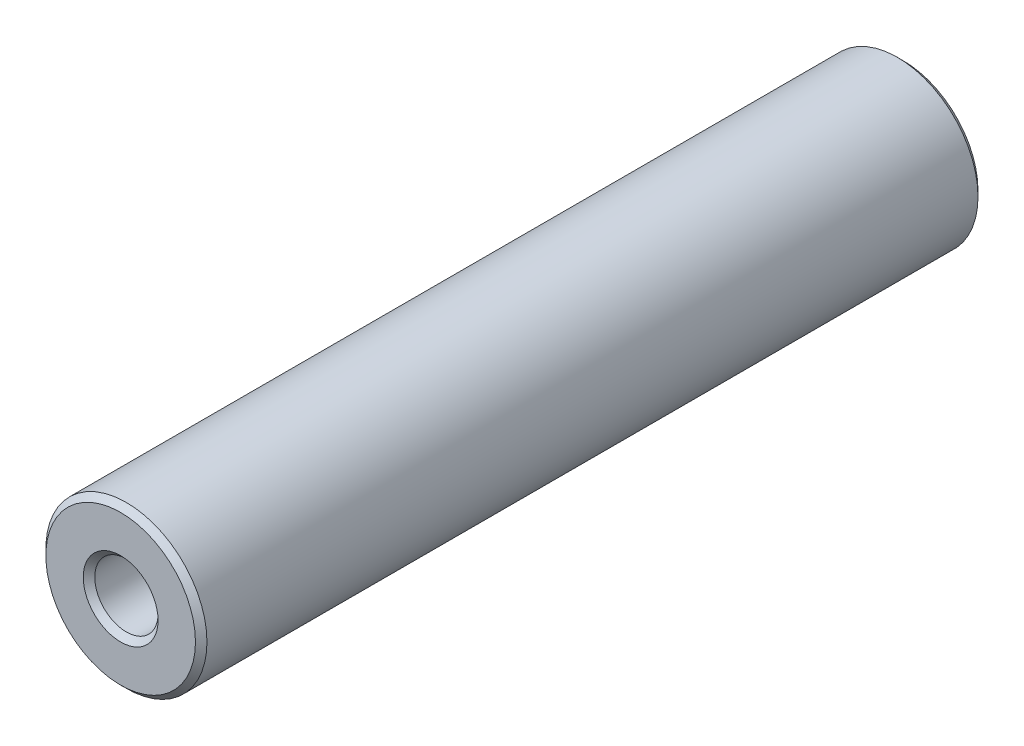
from build123d import *

# Parameters (mm, degrees)
SKETCH1_R           = 7
SKETCH1_R_2         = 2.75
BOSS_EXTRUDE1_DEPTH = 34
CHAMFER1_SIZE       = 0.5
CHAMFER2_SIZE       = 0.5


with BuildPart() as part:
    # Sketch1 → Boss-Extrude1 (new, symmetric)
    with BuildSketch(Plane(origin=(0, 0, 0), x_dir=(0, 1, 0), z_dir=(0, 0, 1))):
        with Locations(Location((0, 0, 0), (0, 0, 270))):
            Circle(SKETCH1_R)
        with Locations(Location((0, 0, 0), (0, 0, 270))):
            Circle(SKETCH1_R_2, mode=Mode.SUBTRACT)
    extrude(amount=BOSS_EXTRUDE1_DEPTH, both=True)

    # Chamfer1
    chamfer1_edges = [part.edges().sort_by_distance(p)[0] for p in [
        (-2.75, 0, -34),
        (-2.75, 0, 34),
    ]]
    chamfer(chamfer1_edges, length=CHAMFER1_SIZE)

    # Chamfer2
    chamfer2_edges = [part.edges().sort_by_distance(p)[0] for p in [
        (-7, 0, -34),
        (-7, 0, 34),
    ]]
    chamfer(chamfer2_edges, length=CHAMFER2_SIZE)


solid = part.part
